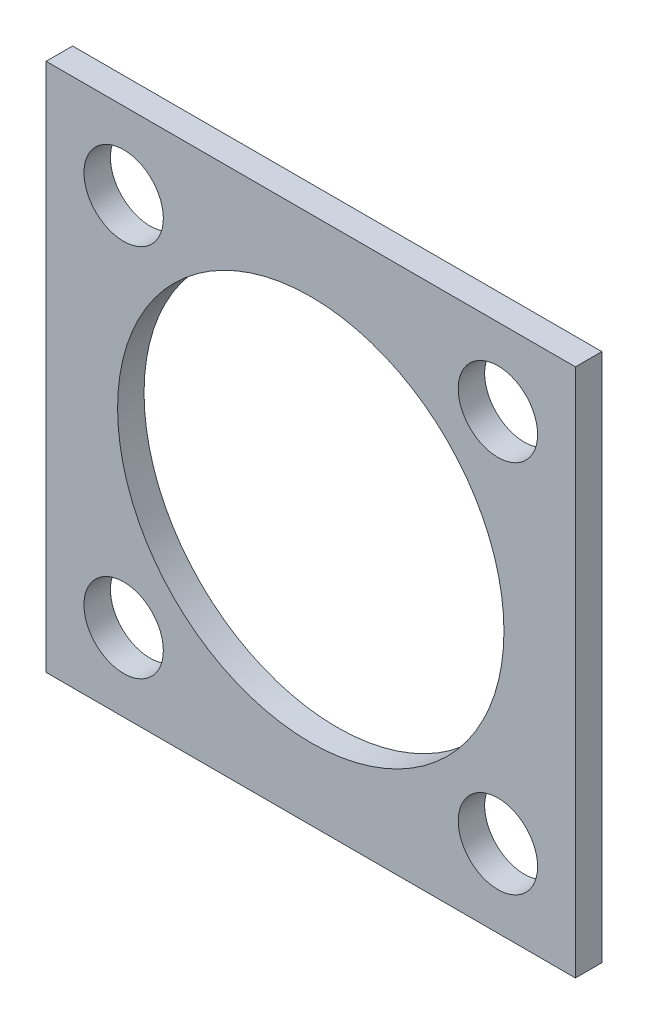
from build123d import *

# Parameters (mm, degrees)
SKETCH1_W           = 20
SKETCH1_H           = 20
SKETCH1_R           = 7.3
BOSS_EXTRUDE1_DEPTH = 1
SKETCH2_R           = 1.5
CUT_EXTRUDE1_DEPTH  = 1


with BuildPart() as part:
    # Sketch1 → Boss-Extrude1 (new body)
    with BuildSketch(Plane.XY):
        Rectangle(SKETCH1_W, SKETCH1_H)
        Circle(SKETCH1_R, mode=Mode.SUBTRACT)
    extrude(amount=BOSS_EXTRUDE1_DEPTH)

    # Sketch2 → Cut-Extrude1 (cut)
    with BuildSketch(Plane.XY.offset(1)):
        with Locations((-7.071067812, 7.071067812)):
            Circle(SKETCH2_R)
        with Locations((7.071067812, 7.071067812)):
            Circle(SKETCH2_R)
        with Locations((7.071067812, -7.071067812)):
            Circle(SKETCH2_R)
        with Locations((-7.071067812, -7.071067812)):
            Circle(SKETCH2_R)
    extrude(amount=-CUT_EXTRUDE1_DEPTH, mode=Mode.SUBTRACT)


solid = part.part
